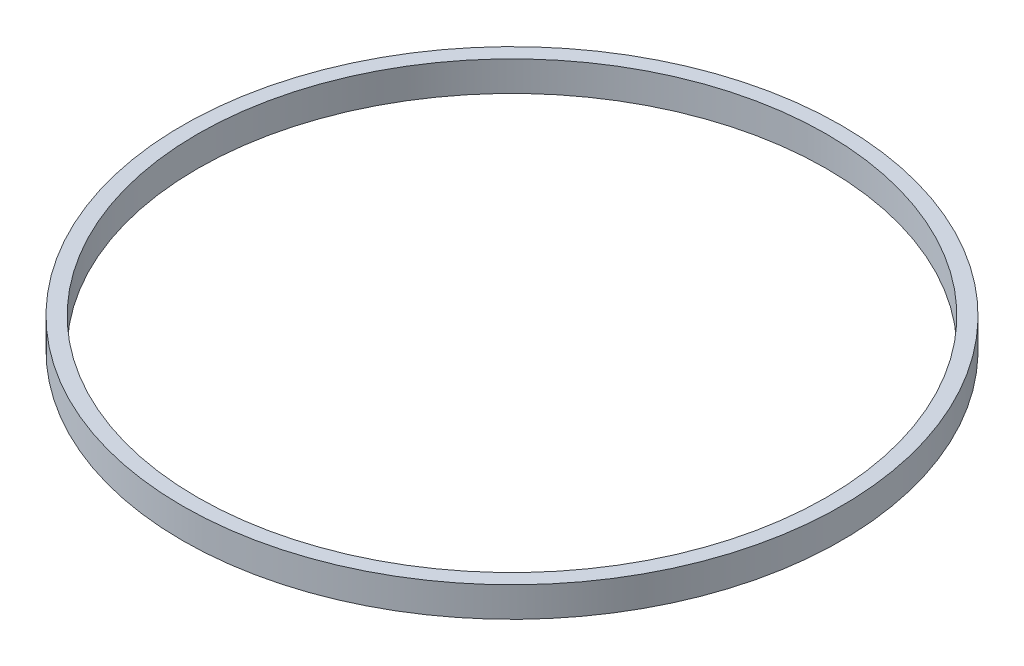
from build123d import *

# Parameters (mm, degrees)
SKETCH2_R           = 33
SKETCH2_R_2         = 31.5
BOSS_EXTRUDE1_DEPTH = 3


with BuildPart() as part:
    # Sketch2 → Boss-Extrude1 (new body)
    with BuildSketch(Plane(origin=(0, 0, 0), x_dir=(1, 0, 0), z_dir=(0, 1, 0))):
        with Locations(Location((0, 0, 0), (0, 0, 270))):
            Circle(SKETCH2_R)
        with Locations(Location((0, 0, 0), (0, 0, 270))):
            Circle(SKETCH2_R_2, mode=Mode.SUBTRACT)
    extrude(amount=BOSS_EXTRUDE1_DEPTH)


solid = part.part
